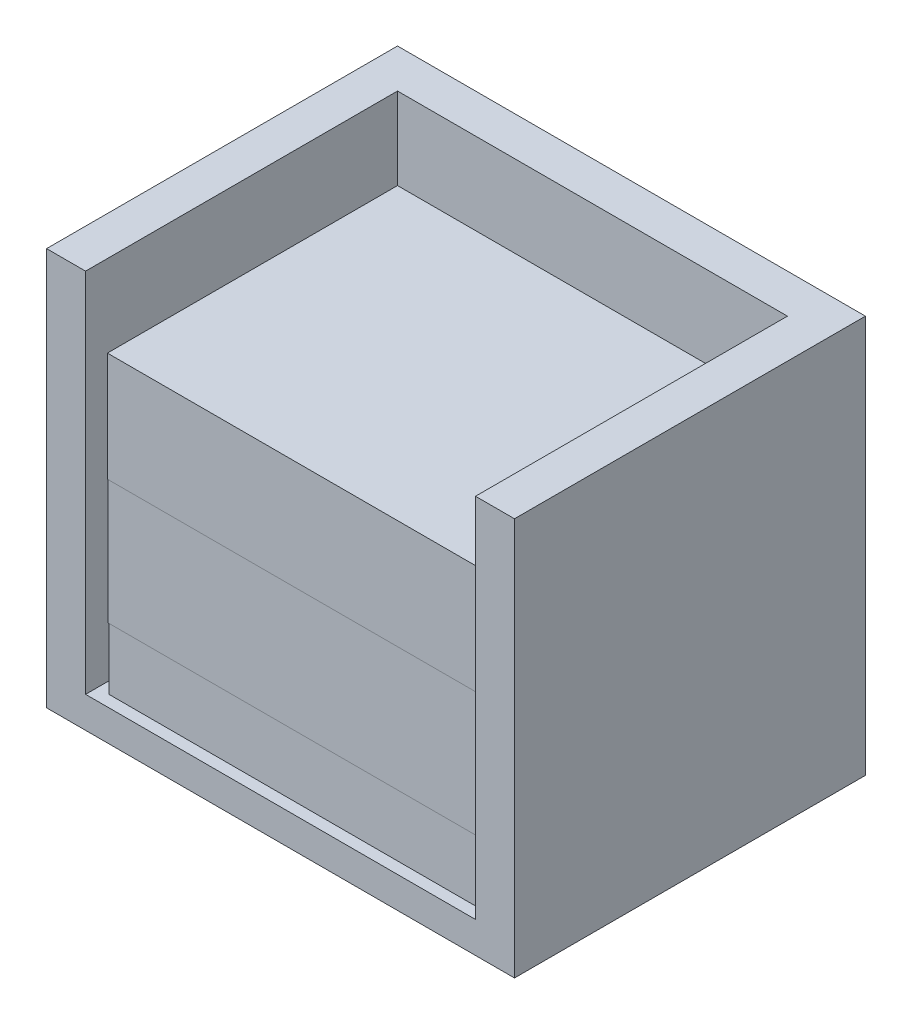
from build123d import *

# Parameters (mm, degrees)
SKETCH1_W           = 500
SKETCH1_H           = 400
BOSS_EXTRUDE2_DEPTH = 510
SKETCH2_W           = 500
SKETCH2_H           = 400
CUT_EXTRUDE1_DEPTH  = 470
SKETCH4_W           = 470
SKETCH4_H           = 370
BOSS_EXTRUDE5_DEPTH = 80
SKETCH6_W           = 470.959249671
SKETCH6_H           = 371.189101319
BOSS_EXTRUDE7_DEPTH = 160
SKETCH7_W           = 472.653238371
SKETCH7_H           = 372.039567124
BOSS_EXTRUDE8_DEPTH = 140
SKETCH8_R           = 150
CUT_EXTRUDE2_DEPTH  = 90


with BuildPart() as part:
    # Sketch1 → Boss-Extrude2 (new body)
    with BuildSketch(Plane(origin=(0, 0, 0), x_dir=(1, 0, 0), z_dir=(0, 1, 0))):
        Polygon((-248.47715736, 234.517766497), (-298.47715736, 234.517766497), (-298.47715736, 184.517766497), (-298.47715736, -215.482233503), (-248.47715736, -215.482233503), (-248.47715736, 184.517766497), (251.52284264, 184.517766497), (251.52284264, -215.482233503), (301.52284264, -215.482233503), (301.52284264, 184.517766497), (301.52284264, 234.517766497), (251.52284264, 234.517766497), align=None)
        with Locations((1.52284264, -15.482233503)):
            Rectangle(SKETCH1_W, SKETCH1_H)
    extrude(amount=BOSS_EXTRUDE2_DEPTH)

    # Sketch2 → Cut-Extrude1 (cut)
    with BuildSketch(Plane(origin=(0, 510, 0), x_dir=(1, 0, 0), z_dir=(0, 1, 0))):
        with Locations((1.52284264, -15.482233503)):
            Rectangle(SKETCH2_W, SKETCH2_H)
    extrude(amount=-CUT_EXTRUDE1_DEPTH, mode=Mode.SUBTRACT)

    # Sketch4 → Boss-Extrude5 (add)
    with BuildSketch(Plane(origin=(0, 40, 0), x_dir=(1, 0, 0), z_dir=(0, 1, 0))):
        with Locations((1.52284264, -15.482233503)):
            Rectangle(SKETCH4_W, SKETCH4_H)
    extrude(amount=BOSS_EXTRUDE5_DEPTH)

    # Sketch6 → Boss-Extrude7 (add)
    with BuildSketch(Plane(origin=(0, 120, 0), x_dir=(1, 0, 0), z_dir=(0, 1, 0))):
        with Locations((2.002467475, -16.076784163)):
            Rectangle(SKETCH6_W, SKETCH6_H)
    extrude(amount=BOSS_EXTRUDE7_DEPTH)

    # Sketch7 → Boss-Extrude8 (add)
    with BuildSketch(Plane(origin=(0, 280, 0), x_dir=(1, 0, 0), z_dir=(0, 1, 0))):
        with Locations((2.849461826, -16.502017065)):
            Rectangle(SKETCH7_W, SKETCH7_H)
    extrude(amount=BOSS_EXTRUDE8_DEPTH)

    # Sketch8 → Cut-Extrude2 (cut)
    with BuildSketch(Plane.XZ):
        with Locations(Location((0, 0, 0), (0, 0, 270))):
            Circle(SKETCH8_R)
    extrude(amount=-CUT_EXTRUDE2_DEPTH, mode=Mode.SUBTRACT)


solid = part.part
